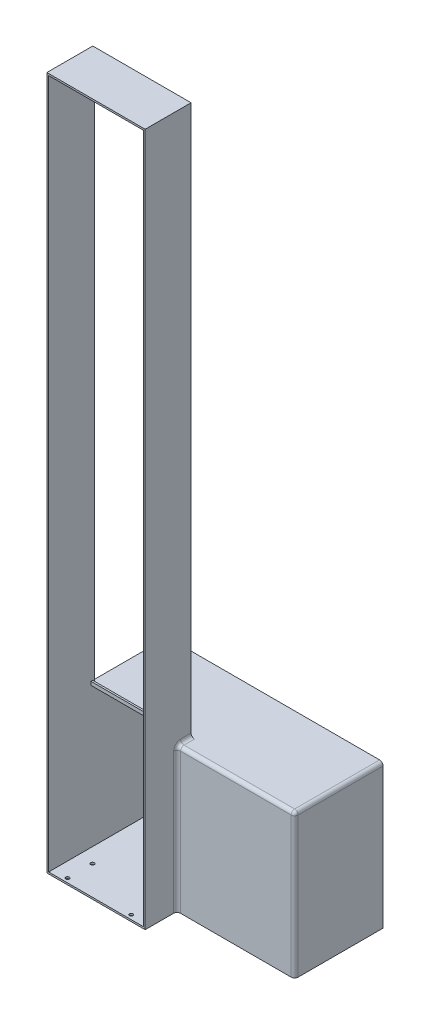
from build123d import *

# Parameters (mm, degrees)
SKETCH3_R                      = 5
BOTTOM_PLATE_DEPTH             = 5
SKETCH4_W                      = 5
SKETCH4_H                      = 343.002
VERTICAL_WALLS_DEPTH           = 400
MID_HORIZONTAL_PLATE_DEPTH     = 5
SKETCH7_W                      = 5
SKETCH7_H                      = 130.782
REST_OF_VERTICAL_EXTRUDE_DEPTH = 1560
SKETCH8_W                      = 280
SKETCH8_H                      = 130.782
TOP_PLATE_DEPTH                = 5
MOTOR_BOX_FILLETS_R            = 10
SKETCH10_W                     = 5
SKETCH10_H                     = 10
BOTTOM_PLATE_LIP_DEPTH         = 270


with BuildPart() as part:
    # Sketch3 → Bottom plate (new body)
    with BuildSketch(Plane.XZ.offset(985.61875)):
        Polygon((-140, 90.3875), (140, 90.3875), (140, -0.5375), (474.951, -0.5375), (474.951, -252.6145), (-140, -252.6145), align=None)
        with Locations(Location((88, -194.6125, 0), (0, 0, 270))):
            Circle(SKETCH3_R, mode=Mode.SUBTRACT)
        with Locations(Location((-93, -194.6125, 0), (0, 0, 270))):
            Circle(SKETCH3_R, mode=Mode.SUBTRACT)
        with Locations(Location((88, 7.3875, 0), (0, 0, 270))):
            Circle(SKETCH3_R, mode=Mode.SUBTRACT)
        with Locations(Location((-93, 7.3875, 0), (0, 0, 270))):
            Circle(SKETCH3_R, mode=Mode.SUBTRACT)
        with Locations(Location((-93, 78.3875, 0), (0, 0, 270))):
            Circle(SKETCH3_R, mode=Mode.SUBTRACT)
        with Locations(Location((88, 78.3875, 0), (0, 0, 270))):
            Circle(SKETCH3_R, mode=Mode.SUBTRACT)
    extrude(amount=BOTTOM_PLATE_DEPTH)

    # Sketch4 → Vertical walls (add)
    with BuildSketch(Plane(origin=(0, -985.61875, 0), x_dir=(1, 0, 0), z_dir=(0, 1, 0))):
        with Locations((-137.5, 81.1135)):
            Rectangle(SKETCH4_W, SKETCH4_H)
        Polygon((135, -90.3875), (135, 5.5375), (469.951, 5.5375), (469.951, 252.6145), (474.951, 252.6145), (474.951, 0.5375), (140, 0.5375), (140, -90.3875), align=None)
    extrude(amount=VERTICAL_WALLS_DEPTH)

    # Sketch6 → Mid horizontal plate (add)
    with BuildSketch(Plane(origin=(0, -585.61875, 0), x_dir=(1, 0, 0), z_dir=(0, 1, 0))):
        Polygon((135, -90.3875), (135, 35.3945), (-135, 35.3945), (-135, -90.3875), (-140, -90.3875), (-140, 252.6145), (-135, 252.6145), (135, 252.6145), (474.951, 252.6145), (474.951, 0.5375), (140, 0.5375), (140, -90.3875), align=None)
    extrude(amount=MID_HORIZONTAL_PLATE_DEPTH)

    # Sketch7 → Rest of vertical extrude (add)
    with BuildSketch(Plane(origin=(0, -580.61875, 0), x_dir=(1, 0, 0), z_dir=(0, 1, 0))):
        with Locations((137.5, -24.9965)):
            Rectangle(SKETCH7_W, SKETCH7_H)
        with Locations((-137.5, -24.9965)):
            Rectangle(SKETCH7_W, SKETCH7_H)
    extrude(amount=REST_OF_VERTICAL_EXTRUDE_DEPTH)

    # Sketch8 → Top plate (add)
    with BuildSketch(Plane(origin=(0, 979.38125, 0), x_dir=(1, 0, 0), z_dir=(0, 1, 0))):
        with Locations((0, -24.9965)):
            Rectangle(SKETCH8_W, SKETCH8_H)
    extrude(amount=TOP_PLATE_DEPTH)

    # Motor box fillets
    motor_box_fillets_edges = [part.edges().sort_by_distance(p)[0] for p in [
        (140, -580.61875, -20.466),
        (140, -785.61875, -0.5375),
        (474.951, -785.61875, -0.5375),
        (307.4755, -580.61875, -0.5375),
        (474.951, -580.61875, -126.576),
    ]]
    fillet(motor_box_fillets_edges, radius=MOTOR_BOX_FILLETS_R)

    # Sketch10 → Bottom plate lip (add)
    with BuildSketch(Plane.ZY.offset(-135)):
        with Locations((-32.8945, -580.61875)):
            Rectangle(SKETCH10_W, SKETCH10_H)
    extrude(amount=BOTTOM_PLATE_LIP_DEPTH)


solid = part.part
